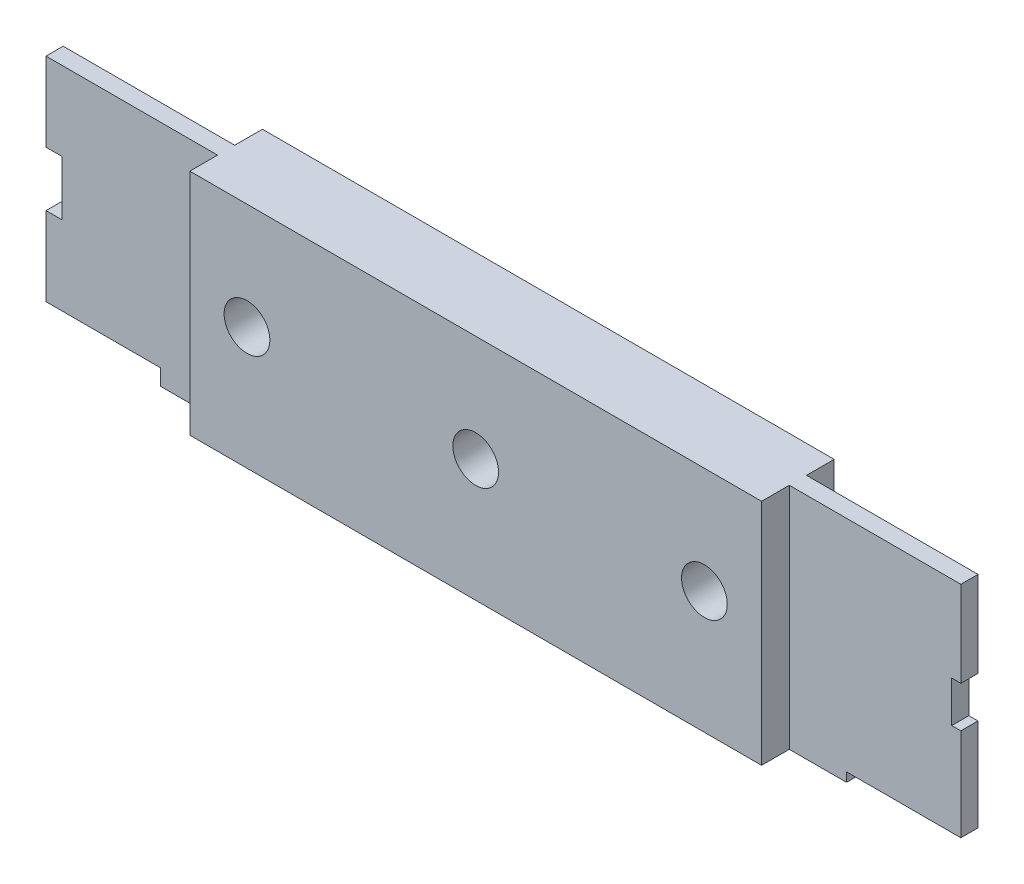
from build123d import *

# Parameters (mm, degrees)
CROQUIS1_R              = 2
SALIENTE_EXTRUIR1_DEPTH = 0.75
CROQUIS2_W              = 50
CROQUIS2_H              = 20
CROQUIS2_R              = 2
SALIENTE_EXTRUIR2_DEPTH = 3.175


with BuildPart() as part:
    # Croquis1 → Saliente-Extruir1 (new, symmetric)
    with BuildSketch(Plane.XY):
        Polygon((-40, 9.3), (40, 9.3), (40, 1.8), (39.2, 1.8), (39.2, -1.8), (40, -1.8), (40, -9.9), (30, -9.9), (30, -10.7), (-30, -10.7), (-30, -9.3), (-40, -9.3), (-40, -2.4), (-38.6, -2.4), (-38.6, 2.4), (-40, 2.4), align=None)
        with Locations((20, 0)):
            Circle(CROQUIS1_R, mode=Mode.SUBTRACT)
        Circle(CROQUIS1_R, mode=Mode.SUBTRACT)
        with Locations((-20, 0)):
            Circle(CROQUIS1_R, mode=Mode.SUBTRACT)
    extrude(amount=SALIENTE_EXTRUIR1_DEPTH, both=True)

    # Croquis2 → Saliente-Extruir2 (add, symmetric)
    with BuildSketch(Plane.XY):
        with Locations((0, -0.7)):
            Rectangle(CROQUIS2_W, CROQUIS2_H)
        with Locations((-20, 0)):
            Circle(CROQUIS2_R, mode=Mode.SUBTRACT)
        Circle(CROQUIS2_R, mode=Mode.SUBTRACT)
        with Locations((20, 0)):
            Circle(CROQUIS2_R, mode=Mode.SUBTRACT)
    extrude(amount=SALIENTE_EXTRUIR2_DEPTH, both=True)


solid = part.part
